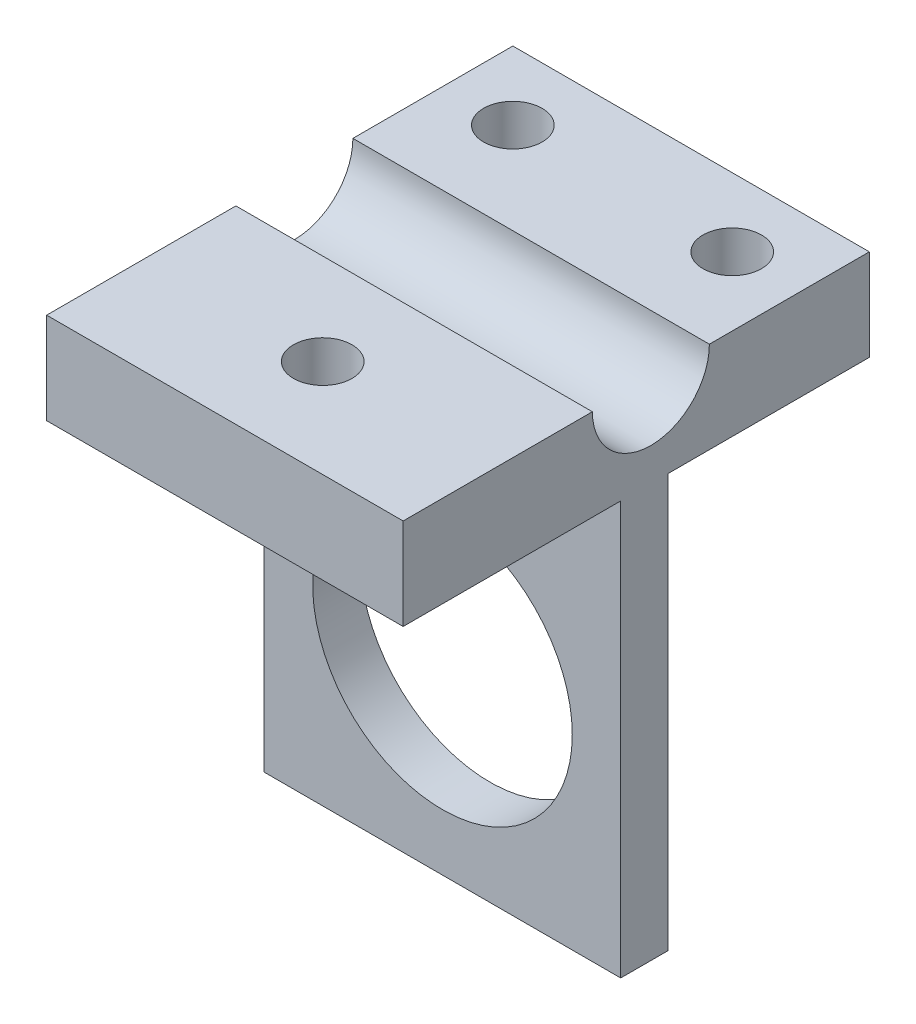
from build123d import *

# Parameters (mm, degrees)
SKETCH11_W          = 24.765
SKETCH11_H          = 32.385
SKETCH11_R          = 2.032
BOSS_EXTRUDE1_DEPTH = 6.35
SKETCH12_W          = 24.765
SKETCH12_H          = 4.064
SKETCH14_W          = 24.765
SKETCH14_H          = 3.302
BOSS_EXTRUDE2_DEPTH = 28.702
CUT_EXTRUDE1_REACH  = 43.659
SKETCH15_R          = 9.017


with BuildPart() as part:
    # Sketch11 → Boss-Extrude1 (new body)
    with BuildSketch(Plane(origin=(0, 0, 0), x_dir=(1, 0, 0), z_dir=(0, 1, 0))):
        with Locations((12.3825, 16.1925)):
            Rectangle(SKETCH11_W, SKETCH11_H)
        with Locations(Location((4.7625, 27.6225, 0), (0, 0, 270))):
            Circle(SKETCH11_R, mode=Mode.SUBTRACT)
        with Locations(Location((20.0025, 27.6225, 0), (0, 0, 270))):
            Circle(SKETCH11_R, mode=Mode.SUBTRACT)
        with Locations(Location((12.3825, 6.7945, 0), (0, 0, 270))):
            Circle(SKETCH11_R, mode=Mode.SUBTRACT)
    extrude(amount=BOSS_EXTRUDE1_DEPTH)

    # Sketch12 → Cut-Revolve1 (revolve, cut)
    with BuildSketch(Plane(origin=(0, 6.35, 0), x_dir=(1, 0, 0), z_dir=(0, 1, 0))):
        with Locations((12.3825, 15.1765)):
            Rectangle(SKETCH12_W, SKETCH12_H)
    revolve(axis=Axis((0, 6.35, -17.2085), (1, 0, 0)), mode=Mode.SUBTRACT)

    # Sketch14 → Boss-Extrude2 (add)
    with BuildSketch(Plane.XZ):
        with Locations((12.3825, -16.764)):
            Rectangle(SKETCH14_W, SKETCH14_H)
    extrude(amount=BOSS_EXTRUDE2_DEPTH)

    # Sketch15 → Cut-Extrude1 (cut, up to next)
    with BuildSketch(Plane.XY.offset(-15.113), mode=Mode.PRIVATE) as cut_extrude1_sk1:
        with Locations((12.3825, -15.748)):
            Circle(SKETCH15_R)
    cut_extrude1_tool1 = extrude(cut_extrude1_sk1.sketch, amount=-CUT_EXTRUDE1_REACH, mode=Mode.PRIVATE) & part.part
    add(cut_extrude1_tool1.solids().sort_by_distance((12.3825, -15.748, -15.113))[0], mode=Mode.SUBTRACT)


solid = part.part
